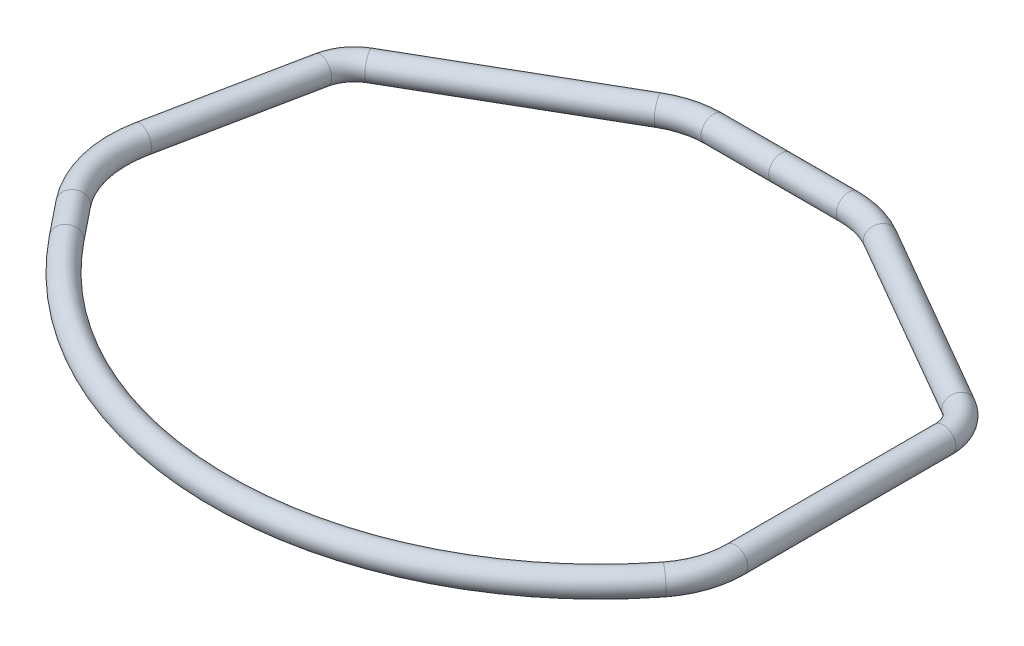
from build123d import *

# Parameters (mm, degrees)
SKETCH2_R = 3.4925


with BuildPart() as part:
    # Sweep1: sweep along a path in Sketch1
    with BuildLine(Plane(origin=(0, -2.640079968, 0), x_dir=(-1, 0, 0), z_dir=(0, -1, 0))) as sweep1_path:
        Line((83.350830382, -38.950762016), (90.921866986, -29.516691169))
        ThreePointArc((90.921866986, -29.516691169), (96.854212201, -17.461644901), (97.114610152, -4.028512237))
        Line((97.114610152, -4.028512237), (88.555415825, 38.286098976))
        ThreePointArc((88.555415825, 38.286098976), (86.599981286, 42.766938519), (82.974870066, 46.04721532))
        Line((82.974870066, 46.04721532), (31.21997499, 75.927917924))
        ThreePointArc((31.21997499, 75.927917924), (25.353847026, 78.357747685), (19.058716307, 79.186517367))
        Line((19.058716307, 79.186517367), (-19.058716307, 79.186517367))
        ThreePointArc((-19.058716307, 79.186517367), (-25.353847026, 78.357747685), (-31.21997499, 75.927917924))
        Line((-31.21997499, 75.927917924), (-83.485748808, 45.752259341))
        ThreePointArc((-83.485748808, 45.752259341), (-87.73988542, 41.498122729), (-89.297007491, 35.686864045))
        Line((-89.297007491, 35.686864045), (-89.297007491, -22.979722438))
        ThreePointArc((-89.297007491, -22.979722438), (-87.965976384, -30.91549024), (-84.118562377, -37.98270043))
        ThreePointArc((-84.118562377, -37.98270043), (-0.617769304, -78.930731865), (83.350830382, -38.950762016))
    # Sketch2 → Sweep1 (sweep)
    with BuildSketch(Plane(origin=(0, 0, 0), x_dir=(0, 0, -1), z_dir=(1, 0, 0))):
        with Locations((79.186517367, -2.640079968)):
            Circle(SKETCH2_R)
    sweep(path=sweep1_path.line)


solid = part.part
